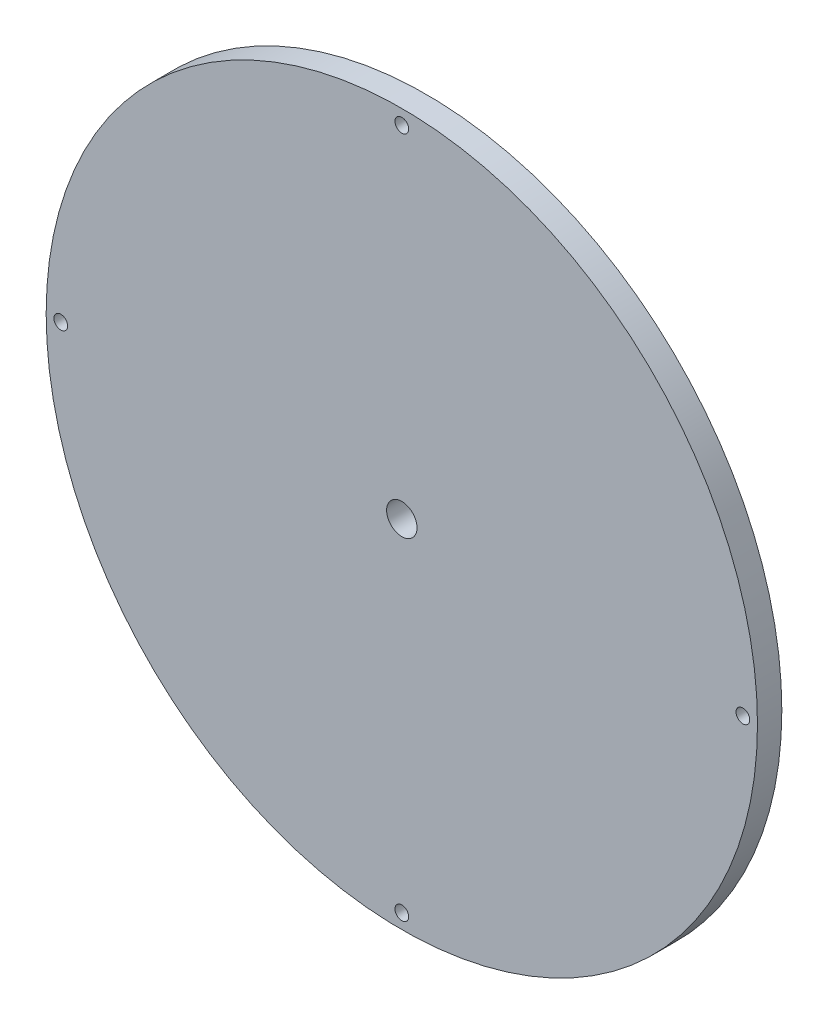
from build123d import *

# Parameters (mm, degrees)
SKETCH1_R           = 92.71
SKETCH1_R_2         = 3.96875
SKETCH1_R_3         = 1.7859375
BOSS_EXTRUDE1_DEPTH = 6.35


with BuildPart() as part:
    # Sketch1 → Boss-Extrude1 (new body)
    with BuildSketch(Plane.XY):
        Circle(SKETCH1_R)
        Circle(SKETCH1_R_2, mode=Mode.SUBTRACT)
        with Locations((0, 88.9)):
            Circle(SKETCH1_R_3, mode=Mode.SUBTRACT)
        with Locations((88.9, 0)):
            Circle(SKETCH1_R_3, mode=Mode.SUBTRACT)
        with Locations((0, -88.9)):
            Circle(SKETCH1_R_3, mode=Mode.SUBTRACT)
        with Locations((-88.9, 0)):
            Circle(SKETCH1_R_3, mode=Mode.SUBTRACT)
    extrude(amount=BOSS_EXTRUDE1_DEPTH)


solid = part.part
